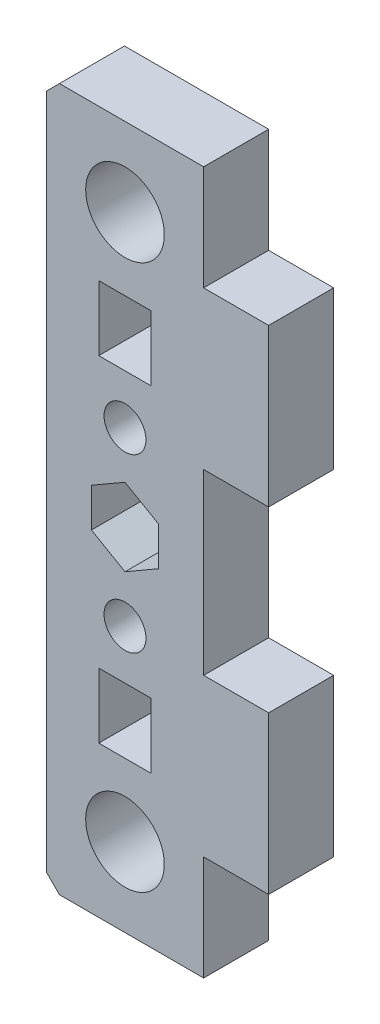
from build123d import *

# Parameters (mm, degrees)
MODEL_R             = 4
MODEL_R_2           = 7.5
MODEL_W             = 10
MODEL_H             = 12.4
BOSS_EXTRUDE1_DEPTH = 12.4


with BuildPart() as part:
    # Model → Boss-Extrude1 (new body)
    with BuildSketch(Plane.XY):
        Polygon((-12.5, 0), (-15, 2.5), (-15, 131.5), (-12.5, 134), (15, 134), (15, 114), (27.4, 114), (27.4, 84), (15, 84), (15, 50), (27.4, 50), (27.4, 20), (15, 20), (15, 0), align=None)
        with Locations(Location((0, 50.609916554, 0), (0, 0, 180))):
            Circle(MODEL_R, mode=Mode.SUBTRACT)
        with Locations(Location((0, 83.390083446, 0), (0, 0, 180))):
            Circle(MODEL_R, mode=Mode.SUBTRACT)
        with Locations(Location((0, 15, 0), (0, 0, 180))):
            Circle(MODEL_R_2, mode=Mode.SUBTRACT)
        with Locations(Location((0, 119, 0), (0, 0, 180))):
            Circle(MODEL_R_2, mode=Mode.SUBTRACT)
        with Locations((0, 99)):
            Rectangle(MODEL_W, MODEL_H, mode=Mode.SUBTRACT)
        Polygon((0, 74.390083446), (-6.4, 70.695041723), (-6.4, 63.304958277), (0, 59.609916554), (6.4, 63.304958277), (6.4, 70.695041723), align=None, mode=Mode.SUBTRACT)
        with Locations((0, 35)):
            Rectangle(MODEL_W, MODEL_H, mode=Mode.SUBTRACT)
    extrude(amount=BOSS_EXTRUDE1_DEPTH)


solid = part.part
